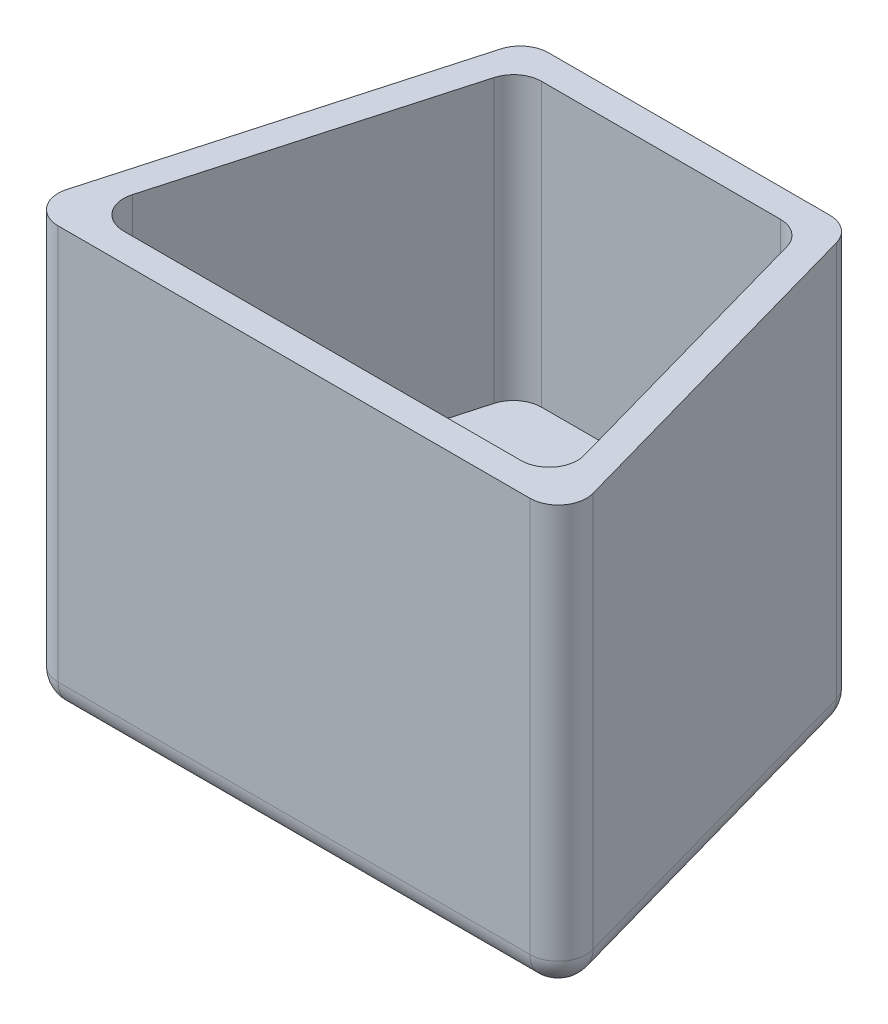
from build123d import *

# Parameters (mm, degrees)
BOSS_EXTRUDE1_DEPTH = 15
BOSS_EXTRUDE2_DEPTH = 5
FILLET1_R           = 1


with BuildPart() as part:
    # Sketch1 → Boss-Extrude1 (new body)
    with BuildSketch(Plane(origin=(0, 0, 0), x_dir=(1, 0, 0), z_dir=(0, 1, 0))):
        with BuildLine():
            Line((-8.359903733, -7), (8.359903733, -7))
            ThreePointArc((8.359903733, -7), (9.157006479, -6.603843698), (9.322554673, -5.729254423))
            Line((9.322554673, -5.729254423), (5.947554673, 6.270745577))
            ThreePointArc((5.947554673, 6.270745577), (5.588747431, 6.797102746), (4.984903733, 7))
            Line((4.984903733, 7), (-4.984903733, 7))
            ThreePointArc((-4.984903733, 7), (-5.588747431, 6.797102746), (-5.947554673, 6.270745577))
            Line((-5.947554673, 6.270745577), (-9.322554673, -5.729254423))
            ThreePointArc((-9.322554673, -5.729254423), (-9.157006479, -6.603843698), (-8.359903733, -7))
        make_face()
        with BuildLine():
            Line((-7.039855599, -6), (7.039855599, -6))
            ThreePointArc((7.039855599, -6), (7.836958346, -5.603843698), (8.002506539, -4.729254423))
            Line((8.002506539, -4.729254423), (5.190006539, 5.270745577))
            ThreePointArc((5.190006539, 5.270745577), (4.831199297, 5.797102746), (4.227355599, 6))
            Line((4.227355599, 6), (-4.227355599, 6))
            ThreePointArc((-4.227355599, 6), (-4.831199297, 5.797102746), (-5.190006539, 5.270745577))
            Line((-5.190006539, 5.270745577), (-8.002506539, -4.729254423))
            ThreePointArc((-8.002506539, -4.729254423), (-7.836958346, -5.603843698), (-7.039855599, -6))
        make_face(mode=Mode.SUBTRACT)
    extrude(amount=BOSS_EXTRUDE1_DEPTH)

    # Sketch2 → Boss-Extrude2 (add)
    with BuildSketch(Plane.XZ):
        with BuildLine():
            Line((-9.322554673, 5.729254423), (-5.947554673, -6.270745577))
            ThreePointArc((-5.947554673, -6.270745577), (-5.588747431, -6.797102746), (-4.984903733, -7))
            Line((-4.984903733, -7), (4.984903733, -7))
            ThreePointArc((4.984903733, -7), (5.588747431, -6.797102746), (5.947554673, -6.270745577))
            Line((5.947554673, -6.270745577), (9.322554673, 5.729254423))
            ThreePointArc((9.322554673, 5.729254423), (9.157006479, 6.603843698), (8.359903733, 7))
            Line((8.359903733, 7), (-8.359903733, 7))
            ThreePointArc((-8.359903733, 7), (-9.157006479, 6.603843698), (-9.322554673, 5.729254423))
        make_face()
    extrude(amount=-BOSS_EXTRUDE2_DEPTH)

    # Fillet1
    fillet1_edges = [part.edges().sort_by_distance(p)[0] for p in [
        (0, 0, 7),
        (-9.157006479, 0, 6.603843698),
        (-7.635054673, 0, -0.270745577),
        (-5.588747431, 0, -6.797102746),
        (0, 0, -7),
        (5.588747431, 0, -6.797102746),
        (7.635054673, 0, -0.270745577),
        (9.157006479, 0, 6.603843698),
    ]]
    fillet(fillet1_edges, radius=FILLET1_R)


solid = part.part
